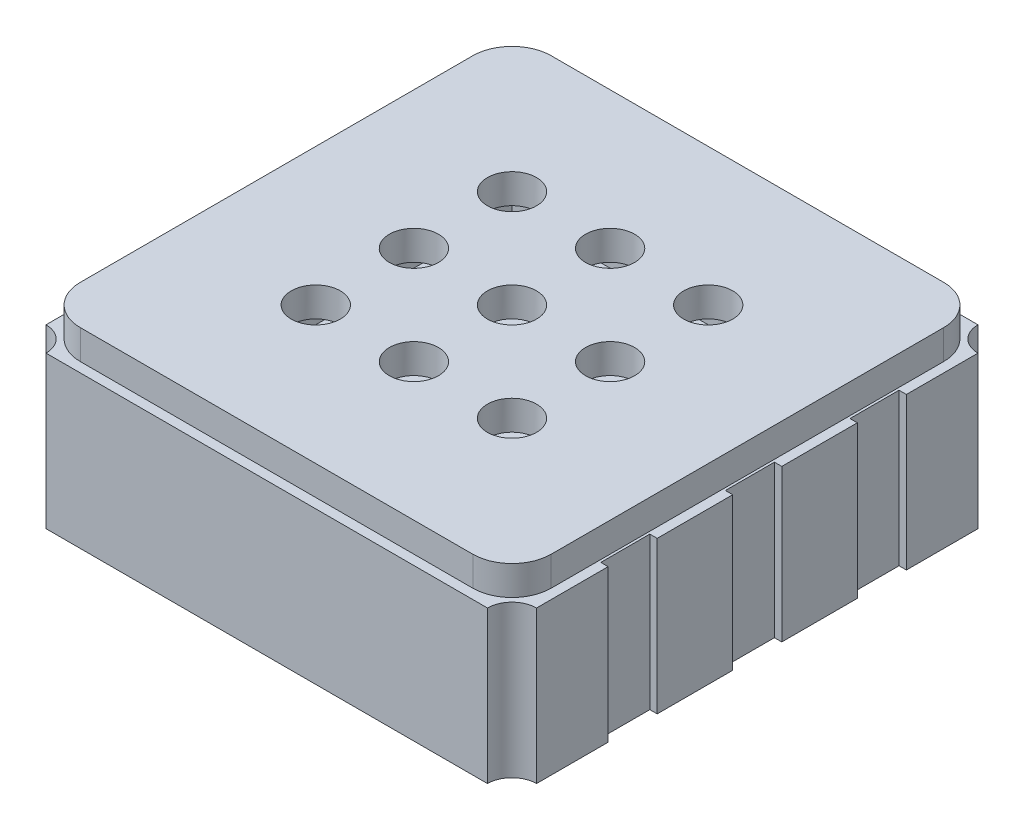
from build123d import *

# Parameters (mm, degrees)
BOSS_EXTRUDE1_DEPTH = 1.55
BOSS_EXTRUDE2_DEPTH = 0.3
SKETCH4_W           = 0.15
SKETCH4_H           = 0.5
CUT_EXTRUDE1_DEPTH  = 1.55
SKETCH5_W           = 4.25
SKETCH5_H           = 4.25
CUT_EXTRUDE2_DEPTH  = 1
CUT_EXTRUDE3_REACH  = 9.309
SKETCH6_R           = 0.25


with BuildPart() as part:
    # Sketch1 → Boss-Extrude1 (new body)
    with BuildSketch(Plane(origin=(0, 0, 0), x_dir=(1, 0, 0), z_dir=(0, 1, 0))):
        with BuildLine():
            ThreePointArc((0, 0.25), (0.176776695, 0.176776695), (0.25, 0))
            Line((0.25, 0), (4.75, 0))
            ThreePointArc((4.75, 0), (4.823223305, 0.176776695), (5, 0.25))
            Line((5, 0.25), (5, 4.75))
            ThreePointArc((5, 4.75), (4.823223305, 4.823223305), (4.75, 5))
            Line((4.75, 5), (0.25, 5))
            ThreePointArc((0.25, 5), (0.176776695, 4.823223305), (0, 4.75))
            Line((0, 4.75), (0, 0.25))
        make_face()
    extrude(amount=BOSS_EXTRUDE1_DEPTH)

    # Sketch2 → Boss-Extrude2 (add)
    with BuildSketch(Plane(origin=(0, 1.55, 0), x_dir=(1, 0, 0), z_dir=(0, 1, 0))):
        with BuildLine():
            Line((0.5, 0.1), (4.5, 0.1))
            ThreePointArc((4.5, 0.1), (4.782842712, 0.217157288), (4.9, 0.5))
            Line((4.9, 0.5), (4.9, 4.5))
            ThreePointArc((4.9, 4.5), (4.782842712, 4.782842712), (4.5, 4.9))
            Line((4.5, 4.9), (0.5, 4.9))
            ThreePointArc((0.5, 4.9), (0.217157288, 4.782842712), (0.1, 4.5))
            Line((0.1, 4.5), (0.1, 0.5))
            ThreePointArc((0.1, 0.5), (0.217157288, 0.217157288), (0.5, 0.1))
        make_face()
    extrude(amount=BOSS_EXTRUDE2_DEPTH)

    # Sketch4 → Cut-Extrude1 (cut)
    with BuildSketch(Plane.XZ):
        with Locations((0, -2.5)):
            Rectangle(SKETCH4_W, SKETCH4_H)
        with Locations((5, -1.23)):
            Rectangle(SKETCH4_W, SKETCH4_H)
        with Locations((0, -1.23)):
            Rectangle(SKETCH4_W, SKETCH4_H)
        with Locations((0, -3.77)):
            Rectangle(SKETCH4_W, SKETCH4_H)
        with Locations((5, -2.5)):
            Rectangle(SKETCH4_W, SKETCH4_H)
        with Locations((5, -3.77)):
            Rectangle(SKETCH4_W, SKETCH4_H)
    extrude(amount=-CUT_EXTRUDE1_DEPTH, mode=Mode.SUBTRACT)

    # Sketch5 → Cut-Extrude2 (cut)
    with BuildSketch(Plane(origin=(0, 1.55, 0), x_dir=(1, 0, 0), z_dir=(0, 1, 0))):
        with Locations((2.5, 2.5)):
            Rectangle(SKETCH5_W, SKETCH5_H)
    extrude(amount=-CUT_EXTRUDE2_DEPTH, mode=Mode.SUBTRACT)

    # Sketch6 → Cut-Extrude3 (cut, up to next)
    with BuildSketch(Plane(origin=(0, 1.85, 0), x_dir=(1, 0, 0), z_dir=(0, 1, 0)), mode=Mode.PRIVATE) as cut_extrude3_sk1:
        with Locations(Location((2.5, 2.5, 0), (0, 0, 270))):
            Circle(SKETCH6_R)
    cut_extrude3_tool1 = extrude(cut_extrude3_sk1.sketch, amount=-CUT_EXTRUDE3_REACH, mode=Mode.PRIVATE) & part.part
    # Sketch6 → Cut-Extrude3 (cut, up to next)
    with BuildSketch(Plane(origin=(0, 1.85, 0), x_dir=(1, 0, 0), z_dir=(0, 1, 0)), mode=Mode.PRIVATE) as cut_extrude3_sk2:
        with Locations(Location((2.5, 1.5, 0), (0, 0, 270))):
            Circle(SKETCH6_R)
    cut_extrude3_tool2 = extrude(cut_extrude3_sk2.sketch, amount=-CUT_EXTRUDE3_REACH, mode=Mode.PRIVATE) & part.part
    # Sketch6 → Cut-Extrude3 (cut, up to next)
    with BuildSketch(Plane(origin=(0, 1.85, 0), x_dir=(1, 0, 0), z_dir=(0, 1, 0)), mode=Mode.PRIVATE) as cut_extrude3_sk3:
        with Locations(Location((2.5, 3.5, 0), (0, 0, 270))):
            Circle(SKETCH6_R)
    cut_extrude3_tool3 = extrude(cut_extrude3_sk3.sketch, amount=-CUT_EXTRUDE3_REACH, mode=Mode.PRIVATE) & part.part
    # Sketch6 → Cut-Extrude3 (cut, up to next)
    with BuildSketch(Plane(origin=(0, 1.85, 0), x_dir=(1, 0, 0), z_dir=(0, 1, 0)), mode=Mode.PRIVATE) as cut_extrude3_sk4:
        with Locations(Location((3.5, 1.5, 0), (0, 0, 270))):
            Circle(SKETCH6_R)
    cut_extrude3_tool4 = extrude(cut_extrude3_sk4.sketch, amount=-CUT_EXTRUDE3_REACH, mode=Mode.PRIVATE) & part.part
    # Sketch6 → Cut-Extrude3 (cut, up to next)
    with BuildSketch(Plane(origin=(0, 1.85, 0), x_dir=(1, 0, 0), z_dir=(0, 1, 0)), mode=Mode.PRIVATE) as cut_extrude3_sk5:
        with Locations(Location((3.5, 2.5, 0), (0, 0, 270))):
            Circle(SKETCH6_R)
    cut_extrude3_tool5 = extrude(cut_extrude3_sk5.sketch, amount=-CUT_EXTRUDE3_REACH, mode=Mode.PRIVATE) & part.part
    # Sketch6 → Cut-Extrude3 (cut, up to next)
    with BuildSketch(Plane(origin=(0, 1.85, 0), x_dir=(1, 0, 0), z_dir=(0, 1, 0)), mode=Mode.PRIVATE) as cut_extrude3_sk6:
        with Locations(Location((3.5, 3.5, 0), (0, 0, 270))):
            Circle(SKETCH6_R)
    cut_extrude3_tool6 = extrude(cut_extrude3_sk6.sketch, amount=-CUT_EXTRUDE3_REACH, mode=Mode.PRIVATE) & part.part
    # Sketch6 → Cut-Extrude3 (cut, up to next)
    with BuildSketch(Plane(origin=(0, 1.85, 0), x_dir=(1, 0, 0), z_dir=(0, 1, 0)), mode=Mode.PRIVATE) as cut_extrude3_sk7:
        with Locations(Location((1.5, 2.5, 0), (0, 0, 270))):
            Circle(SKETCH6_R)
    cut_extrude3_tool7 = extrude(cut_extrude3_sk7.sketch, amount=-CUT_EXTRUDE3_REACH, mode=Mode.PRIVATE) & part.part
    # Sketch6 → Cut-Extrude3 (cut, up to next)
    with BuildSketch(Plane(origin=(0, 1.85, 0), x_dir=(1, 0, 0), z_dir=(0, 1, 0)), mode=Mode.PRIVATE) as cut_extrude3_sk8:
        with Locations(Location((1.5, 3.5, 0), (0, 0, 270))):
            Circle(SKETCH6_R)
    cut_extrude3_tool8 = extrude(cut_extrude3_sk8.sketch, amount=-CUT_EXTRUDE3_REACH, mode=Mode.PRIVATE) & part.part
    # Sketch6 → Cut-Extrude3 (cut, up to next)
    with BuildSketch(Plane(origin=(0, 1.85, 0), x_dir=(1, 0, 0), z_dir=(0, 1, 0)), mode=Mode.PRIVATE) as cut_extrude3_sk9:
        with Locations(Location((1.5, 1.5, 0), (0, 0, 270))):
            Circle(SKETCH6_R)
    cut_extrude3_tool9 = extrude(cut_extrude3_sk9.sketch, amount=-CUT_EXTRUDE3_REACH, mode=Mode.PRIVATE) & part.part
    add(cut_extrude3_tool1.solids().sort_by_distance((2.5, 1.85, -2.5))[0], mode=Mode.SUBTRACT)
    add(cut_extrude3_tool2.solids().sort_by_distance((2.5, 1.85, -1.5))[0], mode=Mode.SUBTRACT)
    add(cut_extrude3_tool3.solids().sort_by_distance((2.5, 1.85, -3.5))[0], mode=Mode.SUBTRACT)
    add(cut_extrude3_tool4.solids().sort_by_distance((3.5, 1.85, -1.5))[0], mode=Mode.SUBTRACT)
    add(cut_extrude3_tool5.solids().sort_by_distance((3.5, 1.85, -2.5))[0], mode=Mode.SUBTRACT)
    add(cut_extrude3_tool6.solids().sort_by_distance((3.5, 1.85, -3.5))[0], mode=Mode.SUBTRACT)
    add(cut_extrude3_tool7.solids().sort_by_distance((1.5, 1.85, -2.5))[0], mode=Mode.SUBTRACT)
    add(cut_extrude3_tool8.solids().sort_by_distance((1.5, 1.85, -3.5))[0], mode=Mode.SUBTRACT)
    add(cut_extrude3_tool9.solids().sort_by_distance((1.5, 1.85, -1.5))[0], mode=Mode.SUBTRACT)


solid = part.part
